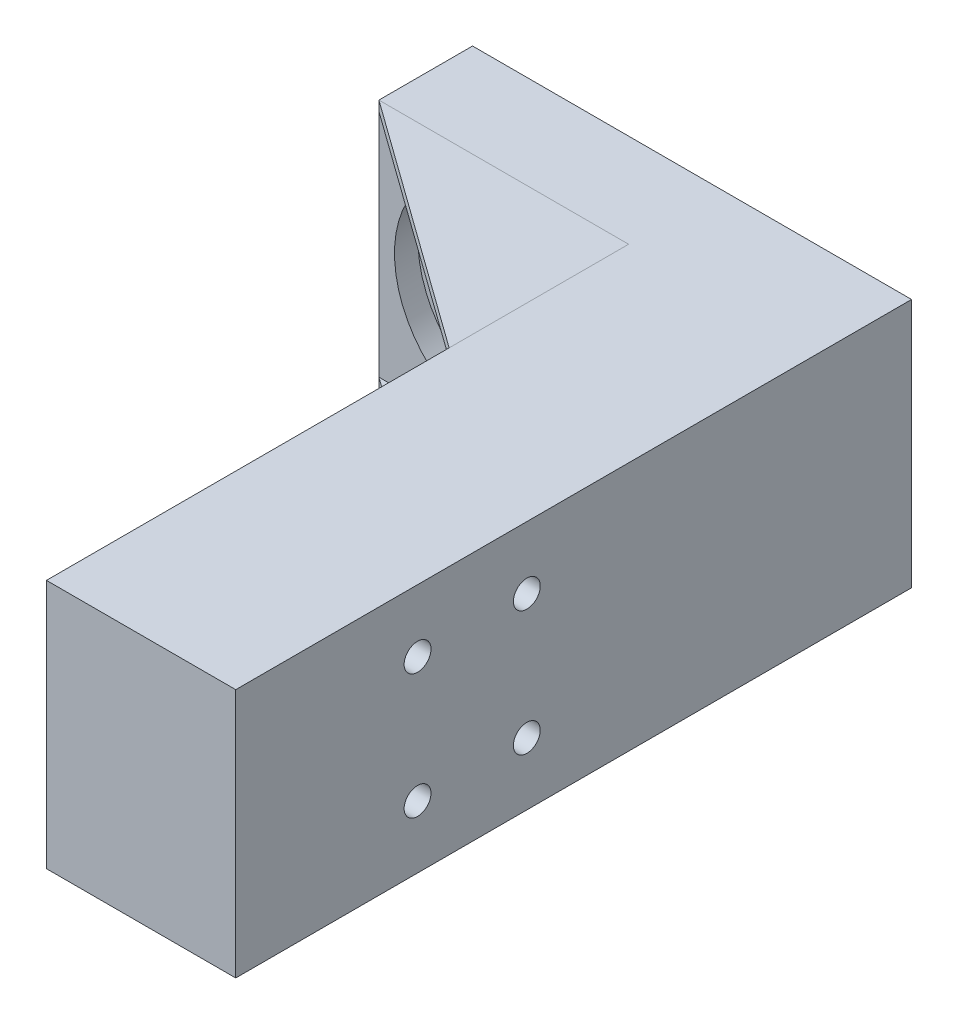
from build123d import *

# Parameters (mm, degrees)
SKETCH1_W           = 32
SKETCH1_H           = 32
BOSS_EXTRUDE1_DEPTH = 12
SKETCH2_W           = 32
SKETCH2_H           = 86.6
BOSS_EXTRUDE2_DEPTH = 24.256442443
SKETCH3_R           = 14
CUT_EXTRUDE1_DEPTH  = 3
SKETCH4_R           = 3
CUT_EXTRUDE2_DEPTH  = 90.831842907
SKETCH9_R           = 1.72
CUT_EXTRUDE3_DEPTH  = 90.831842907
SKETCH10_R          = 1.72
CUT_EXTRUDE4_DEPTH  = 98.711616505
BOSS_EXTRUDE4_DEPTH = 1.25
BOSS_EXTRUDE5_DEPTH = 1.25


with BuildPart() as part:
    # Sketch1 → Boss-Extrude1 (new body)
    with BuildSketch(Plane(origin=(0, 0, 0), x_dir=(0, 1, 0), z_dir=(0, 0, 1))):
        with Locations((16, 16)):
            Rectangle(SKETCH1_W, SKETCH1_H)
    extrude(amount=BOSS_EXTRUDE1_DEPTH)

    # Sketch2 → Boss-Extrude2 (add)
    with BuildSketch(Plane.YZ):
        with Locations((16, 43.3)):
            Rectangle(SKETCH2_W, SKETCH2_H)
    extrude(amount=BOSS_EXTRUDE2_DEPTH)

    # Sketch3 → Cut-Extrude1 (cut)
    with BuildSketch(Plane.XY.offset(12)):
        with Locations((-16, 16)):
            Circle(SKETCH3_R)
    extrude(amount=-CUT_EXTRUDE1_DEPTH, mode=Mode.SUBTRACT)

    # Sketch4 → Cut-Extrude2 (cut, through all)
    with BuildSketch(Plane.XY.offset(9)):
        with Locations((-15.957836343, 16.110848394)):
            Circle(SKETCH4_R)
    extrude(amount=-CUT_EXTRUDE2_DEPTH, mode=Mode.SUBTRACT)

    # Sketch9 → Cut-Extrude3 (cut, through all)
    with BuildSketch(Plane.XY.offset(9)):
        with Locations((-16, 25.35)):
            Circle(SKETCH9_R)
        with Locations((-16, 6.65)):
            Circle(SKETCH9_R)
        with Locations((-6.65, 16)):
            Circle(SKETCH9_R)
        with Locations((-25.307836343, 16)):
            Circle(SKETCH9_R)
    extrude(amount=-CUT_EXTRUDE3_DEPTH, mode=Mode.SUBTRACT)

    # Sketch10 → Cut-Extrude4 (cut, through all)
    with BuildSketch(Plane(origin=(0, 0, 0), x_dir=(0, -1, 0), z_dir=(-1, 0, 0))):
        with Locations(Location((-24, 63.3, 0), (0, 0, 90))):
            Circle(SKETCH10_R)
        with Locations(Location((-24, 49.3, 0), (0, 0, 90))):
            Circle(SKETCH10_R)
        with Locations(Location((-8, 63.3, 0), (0, 0, 90))):
            Circle(SKETCH10_R)
        with Locations(Location((-8, 49.3, 0), (0, 0, 90))):
            Circle(SKETCH10_R)
    extrude(amount=-CUT_EXTRUDE4_DEPTH, mode=Mode.SUBTRACT)

    # Sketch12 → Boss-Extrude4 (add)
    with BuildSketch(Plane(origin=(0, 0, 0), x_dir=(-1, 0, 0), z_dir=(0, 1, 0))):
        Polygon((32, 12), (0, 12), (0, 35), align=None)
    extrude(amount=BOSS_EXTRUDE4_DEPTH)


with BuildPart() as body_2:
    # 3DSketch5 → Boss-Extrude5 (new body)
    with BuildSketch(Plane(origin=(0, 32, 35), x_dir=(-0.812015371342713, 0, -0.583636048152576), z_dir=(0, -1, 0))):
        Polygon((0, 0), (13.423629108, 18.676353541), (39.40812099, 0), align=None)
    extrude(amount=BOSS_EXTRUDE5_DEPTH)


solid = Compound([part.part, body_2.part])
